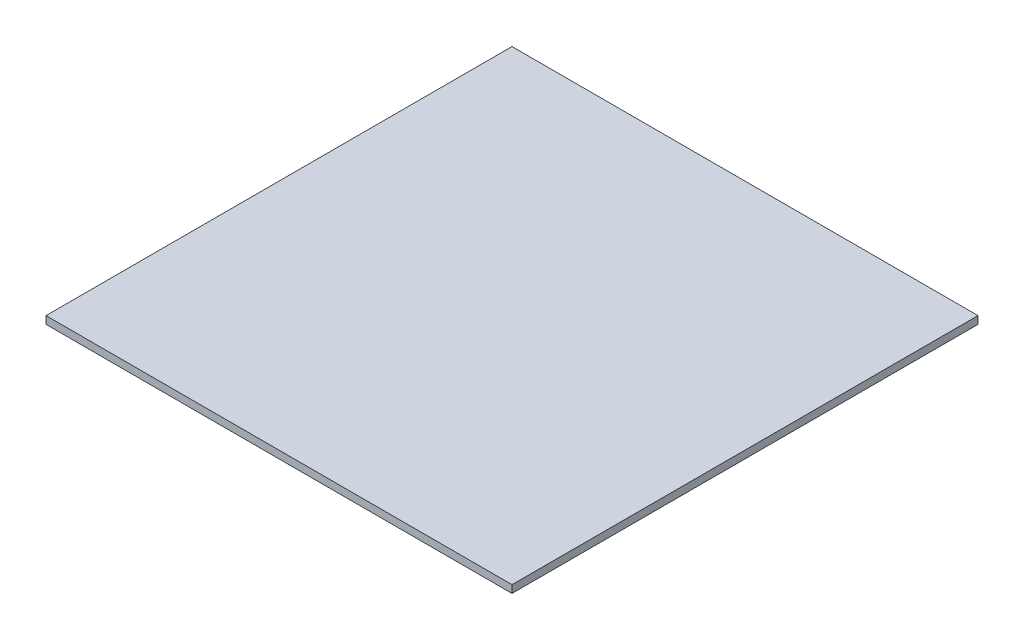
from build123d import *

# Parameters (mm, degrees)
SKETCH2_W           = 245
SKETCH2_H           = 245
BOSS_EXTRUDE1_DEPTH = 4


with BuildPart() as part:
    # Sketch2 → Boss-Extrude1 (new body)
    with BuildSketch(Plane(origin=(0, 0, 0), x_dir=(1, 0, 0), z_dir=(0, 1, 0))):
        Rectangle(SKETCH2_W, SKETCH2_H)
    extrude(amount=BOSS_EXTRUDE1_DEPTH)


solid = part.part
